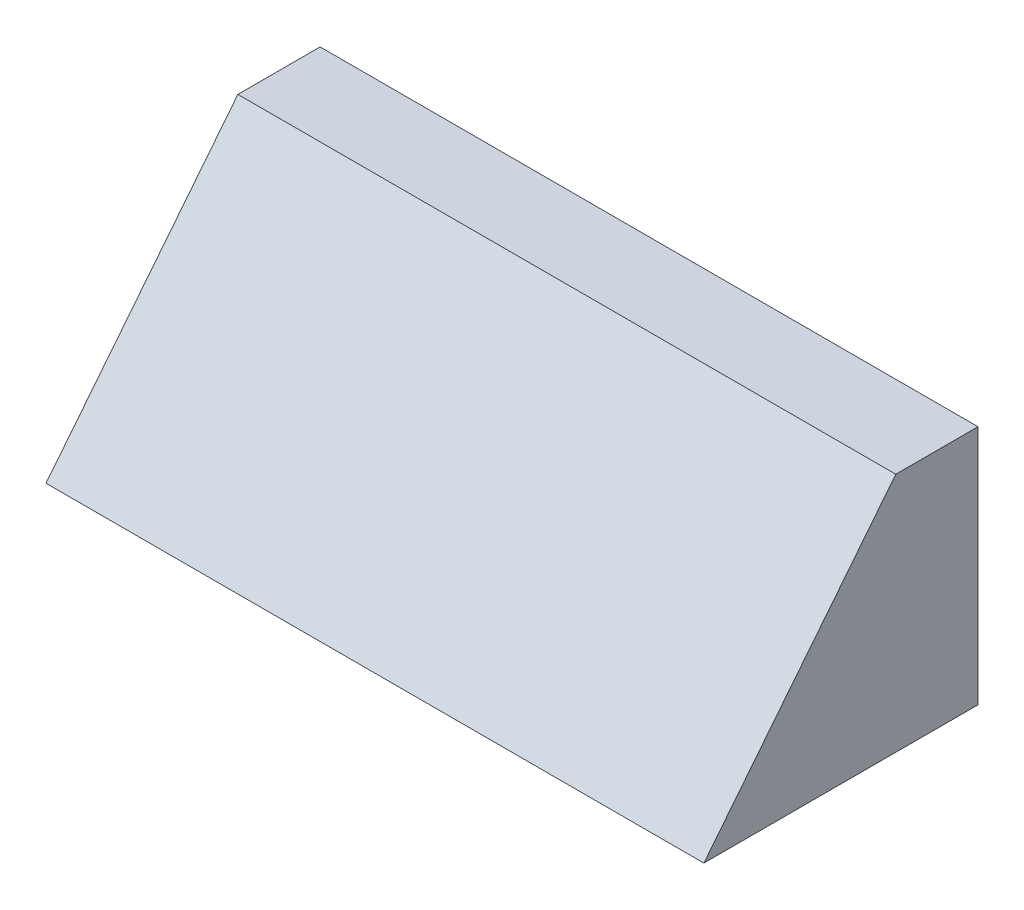
from build123d import *

# Parameters (mm, degrees)
EXTRUDE_1_DEPTH = 48


with BuildPart() as part:
    # 草圖1 → 填料-伸長1 (new body)
    with BuildSketch(Plane(origin=(0, 0, 0), x_dir=(0, 0, -1), z_dir=(1, 0, 0))):
        Polygon((10, 8.785714286), (4, 8.785714286), (-10, -8.785714286), (10, -8.785714286), align=None)
    extrude(amount=EXTRUDE_1_DEPTH)


solid = part.part
